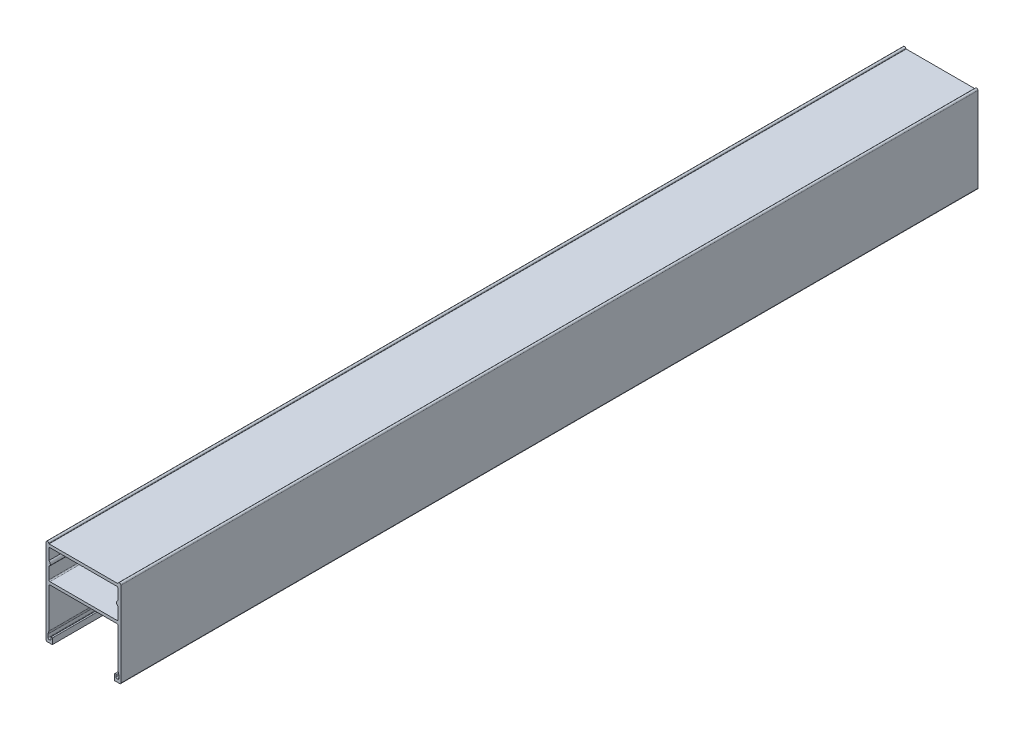
from build123d import *

# Parameters (mm, degrees)
BOSS_EXTRUDE1_DEPTH = 300


with BuildPart() as part:
    # Sketch1 → Boss-Extrude1 (new body)
    with BuildSketch(Plane.XY):
        with BuildLine():
            Line((-12.008392022, 30), (12.008392022, 30))
            ThreePointArc((12.008392022, 30), (12.072941744, 30.023623738), (12.106993351, 30.083333333))
            ThreePointArc((12.106993351, 30.083333333), (12.64181313, 30.498248595), (13.1, 30))
            Line((13.1, 30), (13.1, 17.7))
            Line((13.1, 17.7), (13.1, 0.4))
            ThreePointArc((13.1, 0.4), (12.982842712, 0.117157288), (12.7, 0))
            Line((12.7, 0), (10.9, 0))
            Line((10.9, 0), (10.9, 2))
            ThreePointArc((10.9, 2), (11.148496927, 2.248496927), (11.396993855, 2))
            Line((11.396993855, 2), (11.396993855, 1.4))
            ThreePointArc((11.396993855, 1.4), (11.514151142, 1.117157288), (11.796993855, 1))
            Line((11.796993855, 1), (11.996993855, 1))
            ThreePointArc((11.996993855, 1), (12.279836567, 1.117157288), (12.396993855, 1.4))
            Line((12.396993855, 1.4), (12.396993855, 2.441856285))
            ThreePointArc((12.396993855, 2.441856285), (12.3928338, 2.499395297), (12.380440165, 2.555737483))
            Line((12.380440165, 2.555737483), (12.11655369, 3.444262517))
            ThreePointArc((12.11655369, 3.444262517), (12.104160055, 3.500604703), (12.1, 3.558143715))
            Line((12.1, 3.558143715), (12.1, 17.3))
            ThreePointArc((12.1, 17.3), (11.982842712, 17.582842712), (11.7, 17.7))
            Line((11.7, 17.7), (-11.7, 17.7))
            ThreePointArc((-11.7, 17.7), (-11.982842712, 17.582842712), (-12.1, 17.3))
            Line((-12.1, 17.3), (-12.1, 3.558143715))
            ThreePointArc((-12.1, 3.558143715), (-12.104160055, 3.500604703), (-12.11655369, 3.444262517))
            Line((-12.11655369, 3.444262517), (-12.380440165, 2.555737483))
            ThreePointArc((-12.380440165, 2.555737483), (-12.3928338, 2.499395297), (-12.396993855, 2.441856285))
            Line((-12.396993855, 2.441856285), (-12.396993855, 1.4))
            ThreePointArc((-12.396993855, 1.4), (-12.279836567, 1.117157288), (-11.996993855, 1))
            Line((-11.996993855, 1), (-11.796993855, 1))
            ThreePointArc((-11.796993855, 1), (-11.514151142, 1.117157288), (-11.396993855, 1.4))
            Line((-11.396993855, 1.4), (-11.396993855, 2))
            ThreePointArc((-11.396993855, 2), (-11.148496927, 2.248496927), (-10.9, 2))
            Line((-10.9, 2), (-10.9, 0))
            Line((-10.9, 0), (-12.7, 0))
            ThreePointArc((-12.7, 0), (-12.982842712, 0.117157288), (-13.1, 0.4))
            Line((-13.1, 0.4), (-13.1, 17.7))
            Line((-13.1, 17.7), (-13.1, 30))
            ThreePointArc((-13.1, 30), (-12.64181313, 30.498248595), (-12.106993351, 30.083333333))
            ThreePointArc((-12.106993351, 30.083333333), (-12.072941744, 30.023623738), (-12.008392022, 30))
        make_face()
        with BuildLine():
            Line((-12.1, 28.6), (-12.1, 24.889865053))
            ThreePointArc((-12.1, 24.889865053), (-11.6, 24.02383965), (-12.1, 23.157814246))
            Line((-12.1, 23.157814246), (-12.1, 19.1))
            ThreePointArc((-12.1, 19.1), (-11.982842712, 18.817157288), (-11.7, 18.7))
            Line((-11.7, 18.7), (11.7, 18.7))
            ThreePointArc((11.7, 18.7), (11.982842712, 18.817157288), (12.1, 19.1))
            Line((12.1, 19.1), (12.1, 23.157814246))
            ThreePointArc((12.1, 23.157814246), (11.6, 24.02383965), (12.1, 24.889865053))
            Line((12.1, 24.889865053), (12.1, 28.6))
            ThreePointArc((12.1, 28.6), (11.982842712, 28.882842712), (11.7, 29))
            Line((11.7, 29), (0.173205081, 29))
            Line((0.173205081, 29), (0, 29.3))
            Line((0, 29.3), (-0.173205081, 29))
            Line((-0.173205081, 29), (-11.7, 29))
            ThreePointArc((-11.7, 29), (-11.982842712, 28.882842712), (-12.1, 28.6))
        make_face(mode=Mode.SUBTRACT)
    extrude(amount=BOSS_EXTRUDE1_DEPTH)


solid = part.part
